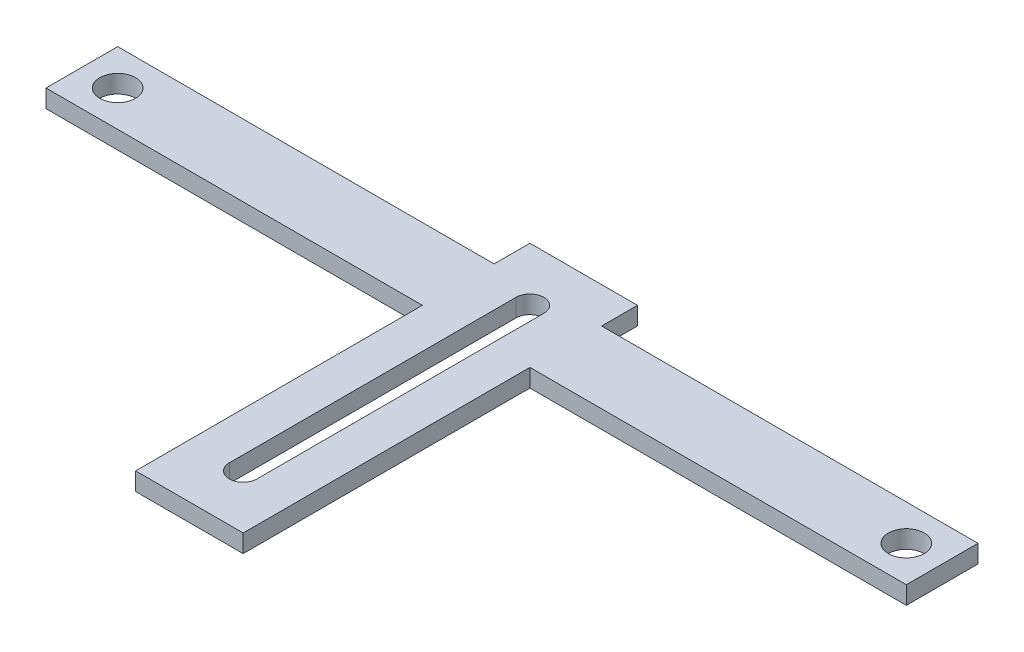
from build123d import *

# Parameters (mm, degrees)
SKETCH1_W           = 304.8
SKETCH1_H           = 25.4
SKETCH1_R           = 6.35
BOSS_EXTRUDE1_DEPTH = 6.35
BOSS_EXTRUDE2_DEPTH = 6.35
CUT_EXTRUDE1_REACH  = 192.606


with BuildPart() as part:
    # Sketch1 → Boss-Extrude1 (new body)
    with BuildSketch(Plane(origin=(0, 0, 0), x_dir=(1, 0, 0), z_dir=(0, 1, 0))):
        Rectangle(SKETCH1_W, SKETCH1_H)
        with Locations(Location((-139.7, 0, 0), (0, 0, 270))):
            Circle(SKETCH1_R, mode=Mode.SUBTRACT)
        with Locations(Location((139.7, 0, 0), (0, 0, 270))):
            Circle(SKETCH1_R, mode=Mode.SUBTRACT)
    extrude(amount=BOSS_EXTRUDE1_DEPTH)

    # Sketch2 → Boss-Extrude2 (add)
    with BuildSketch(Plane(origin=(0, 6.35, 0), x_dir=(1, 0, 0), z_dir=(0, 1, 0))):
        Polygon((-19.05, -12.7), (-19.05, -114.3), (19.05, -114.3), (19.05, -12.7), (19.05, 25.4), (-19.05, 25.4), align=None)
    extrude(amount=-BOSS_EXTRUDE2_DEPTH)

    # Sketch3 → Cut-Extrude1 (cut, up to next)
    with BuildSketch(Plane(origin=(0, 6.35, 0), x_dir=(1, 0, 0), z_dir=(0, 1, 0)), mode=Mode.PRIVATE) as cut_extrude1_sk1:
        with BuildLine():
            Line((-4.922940563, -95.25), (-4.922940563, 6.35))
            ThreePointArc((-4.922940563, 6.35), (0, 11.272940563), (4.922940563, 6.35))
            Line((4.922940563, 6.35), (4.922940563, -95.25))
            ThreePointArc((4.922940563, -95.25), (0, -100.172940563), (-4.922940563, -95.25))
        make_face()
    cut_extrude1_tool1 = extrude(cut_extrude1_sk1.sketch, amount=-CUT_EXTRUDE1_REACH, mode=Mode.PRIVATE) & part.part
    add(cut_extrude1_tool1.solids().sort_by_distance((0, 6.35, 44.45))[0], mode=Mode.SUBTRACT)


solid = part.part
